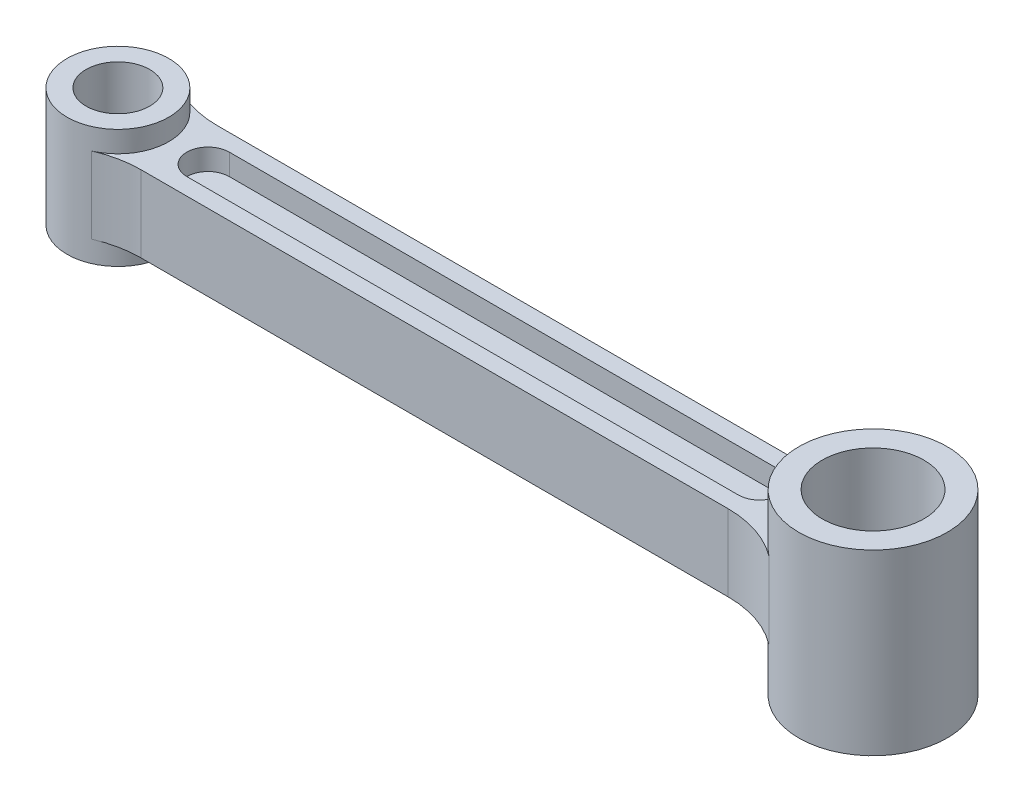
from build123d import *

# Parameters (mm, degrees)
SKETCH1_R           = 7.5
BOSS_EXTRUDE1_DEPTH = 14
SKETCH1_3_R         = 12
BOSS_EXTRUDE2_DEPTH = 21
BOSS_EXTRUDE3_DEPTH = 9
CUT_EXTRUDE1_START  = 9
CUT_EXTRUDE1_DEPTH  = 5


with BuildPart() as part:
    # Sketch1 → Boss-Extrude1 (new, symmetric)
    with BuildSketch(Plane(origin=(0, 0, 0), x_dir=(1, 0, 0), z_dir=(0, 1, 0))):
        with BuildLine():
            ThreePointArc((-42.333170882, 0), (-44.294496212, 6.574573055), (-49.537339359, 11))
            ThreePointArc((-49.537339359, 11), (-66.333170882, 0), (-49.537339359, -11))
            ThreePointArc((-49.537339359, -11), (-44.294496212, -6.574573055), (-42.333170882, 0))
        make_face()
        with Locations((-54.333170882, 0)):
            Circle(SKETCH1_R, mode=Mode.SUBTRACT)
    extrude(amount=BOSS_EXTRUDE1_DEPTH, both=True)



with BuildPart() as body_2:
    # Sketch1<3> → Boss-Extrude2 (new, symmetric)
    with BuildSketch(Plane(origin=(0, 0, 0), x_dir=(1, 0, 0), z_dir=(0, 1, 0))):
        with BuildLine():
            ThreePointArc((141.166829118, 0), (131.430475798, 15.683615343), (113.055310235, 13.915662651))
            ThreePointArc((113.055310235, 13.915662651), (106.166829118, 0), (113.055310235, -13.915662651))
            ThreePointArc((113.055310235, -13.915662651), (131.430475798, -15.683615343), (141.166829118, 0))
        make_face()
        with Locations((123.666829118, 0)):
            Circle(SKETCH1_3_R, mode=Mode.SUBTRACT)
    extrude(amount=BOSS_EXTRUDE2_DEPTH, both=True)


with BuildPart() as part_1:
    add(part.part)

    add(body_2.part)  # Boss-Extrude3 merges body 2
    # Sketch1<4> → Boss-Extrude3 (add, symmetric)
    with BuildSketch(Plane(origin=(0, 0, 0), x_dir=(1, 0, 0), z_dir=(0, 1, 0))):
        with BuildLine():
            Line((98.502370054, 9), (-39.945676312, 9))
            ThreePointArc((-39.945676312, 9), (-44.844655798, 9.505319751), (-49.537339359, 11))
            ThreePointArc((-49.537339359, 11), (-42.333170882, 0), (-49.537339359, -11))
            ThreePointArc((-49.537339359, -11), (-44.844655798, -9.505319751), (-39.945676312, -9))
            Line((-39.945676312, -9), (98.502370054, -9))
            ThreePointArc((98.502370054, -9), (106.182731491, -10.26210106), (113.055310235, -13.915662651))
            ThreePointArc((113.055310235, -13.915662651), (106.166829118, 0), (113.055310235, 13.915662651))
            ThreePointArc((113.055310235, 13.915662651), (106.182731491, 10.26210106), (98.502370054, 9))
        make_face()
    extrude(amount=BOSS_EXTRUDE3_DEPTH, both=True)

    # Sketch1<5> → Cut-Extrude1 (cut)
    with BuildSketch(Plane(origin=(0, 0, 0), x_dir=(1, 0, 0), z_dir=(0, 1, 0)).offset(CUT_EXTRUDE1_START)):
        with BuildLine():
            Line((-33.083170882, 5), (96.916829118, 5))
            ThreePointArc((96.916829118, 5), (101.916829118, 0), (96.916829118, -5))
            Line((96.916829118, -5), (-33.083170882, -5))
            ThreePointArc((-33.083170882, -5), (-38.083170882, 0), (-33.083170882, 5))
        make_face()
    cut_extrude1 = extrude(amount=-CUT_EXTRUDE1_DEPTH, mode=Mode.SUBTRACT)

    # Mirror1: Cut-Extrude1 across plane
    add(cut_extrude1.mirror(Plane.ZX), mode=Mode.SUBTRACT)


solid = part_1.part
